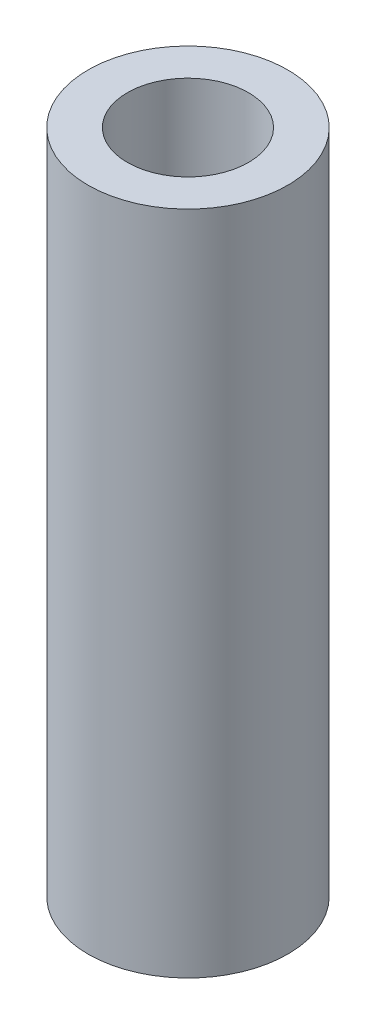
from build123d import *

# Parameters (mm, degrees)
SKETCH_M2_R      = 1.65
SKETCH_M2_R_2    = 1
EXTRUDE_M2_DEPTH = 11


with BuildPart() as part:
    # M2铜柱草图 → M2铜柱 (new body)
    with BuildSketch(Plane(origin=(0, 0, 0), x_dir=(1, 0, 0), z_dir=(0, 1, 0))):
        with Locations(Location((0, 0, 0), (0, 0, 270))):
            Circle(SKETCH_M2_R)
        with Locations(Location((0, 0, 0), (0, 0, 270))):
            Circle(SKETCH_M2_R_2, mode=Mode.SUBTRACT)
    extrude(amount=EXTRUDE_M2_DEPTH)


solid = part.part
